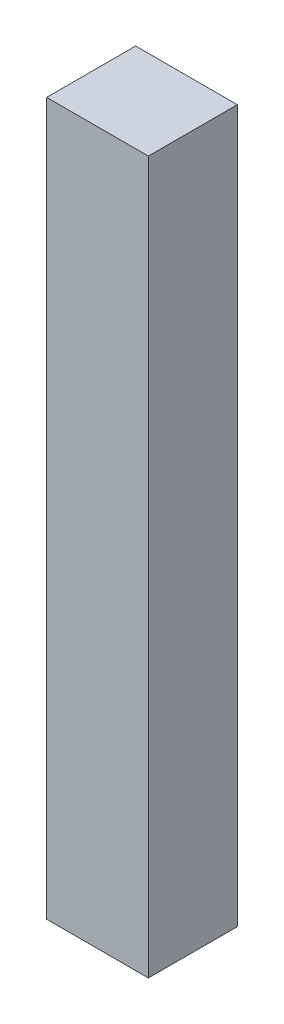
from build123d import *

# Parameters (mm, degrees)
SKETCH2_W           = 8
SKETCH2_H           = 7
BOSS_EXTRUDE1_DEPTH = 28


with BuildPart() as part:
    # Sketch2 → Boss-Extrude1 (new, symmetric)
    with BuildSketch(Plane(origin=(0, 0, 0), x_dir=(1, 0, 0), z_dir=(0, 1, 0))):
        Rectangle(SKETCH2_W, SKETCH2_H)
    extrude(amount=BOSS_EXTRUDE1_DEPTH, both=True)


solid = part.part
